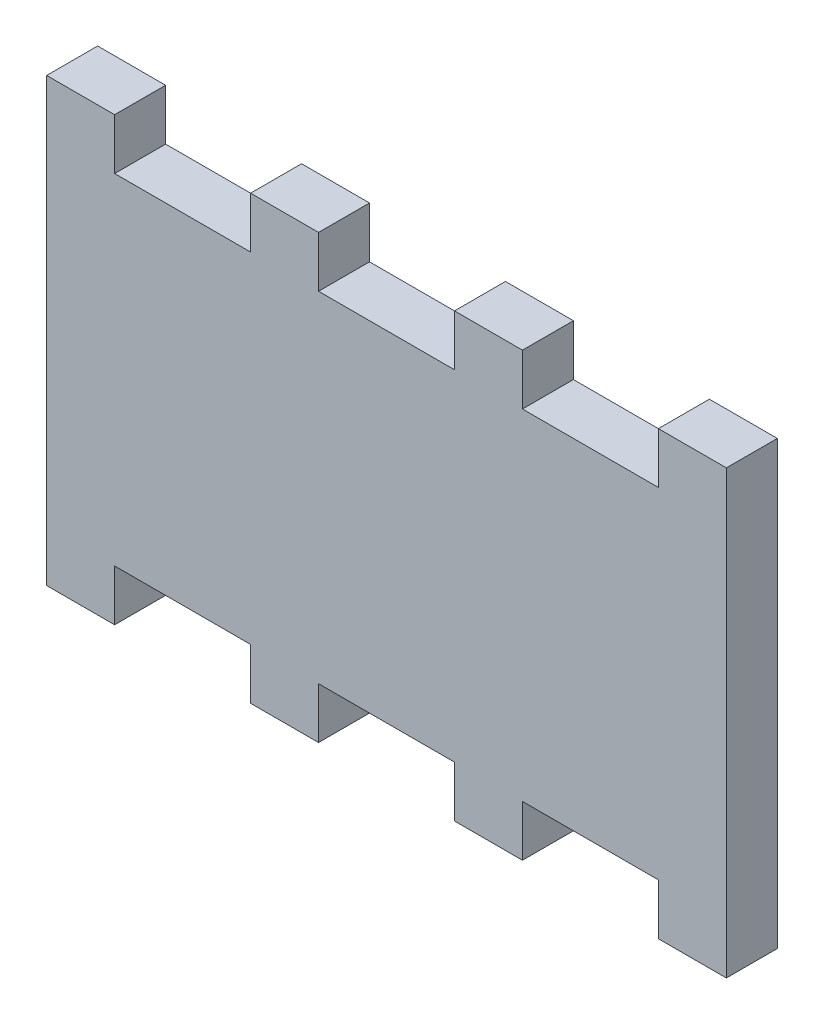
from build123d import *

# Parameters (mm, degrees)
ESQUISSE1_W        = 8
ESQUISSE1_H        = 6
BOSS_EXTRU_1_DEPTH = 6


with BuildPart() as part:
    # Esquisse1 → Boss.-Extru.1 (new body)
    with BuildSketch(Plane.XY):
        with Locations((4, -3)):
            Rectangle(ESQUISSE1_W, ESQUISSE1_H)
        with Locations((28, -3)):
            Rectangle(ESQUISSE1_W, ESQUISSE1_H)
        with Locations((52, -3)):
            Rectangle(ESQUISSE1_W, ESQUISSE1_H)
        Polygon((80, 20), (0, 20), (0, 0), (8, 0), (24, 0), (32, 0), (48, 0), (56, 0), (72, 0), (80, 0), align=None)
        Polygon((0, 40), (0, 20), (80, 20), (80, 40), (72, 40), (56, 40), (48, 40), (32, 40), (24, 40), (8, 40), align=None)
        with Locations((76, 43)):
            Rectangle(ESQUISSE1_W, ESQUISSE1_H)
        with Locations((52, 43)):
            Rectangle(ESQUISSE1_W, ESQUISSE1_H)
        with Locations((28, 43)):
            Rectangle(ESQUISSE1_W, ESQUISSE1_H)
        with Locations((4, 43)):
            Rectangle(ESQUISSE1_W, ESQUISSE1_H)
        with Locations((76, -3)):
            Rectangle(ESQUISSE1_W, ESQUISSE1_H)
    extrude(amount=BOSS_EXTRU_1_DEPTH)


solid = part.part
